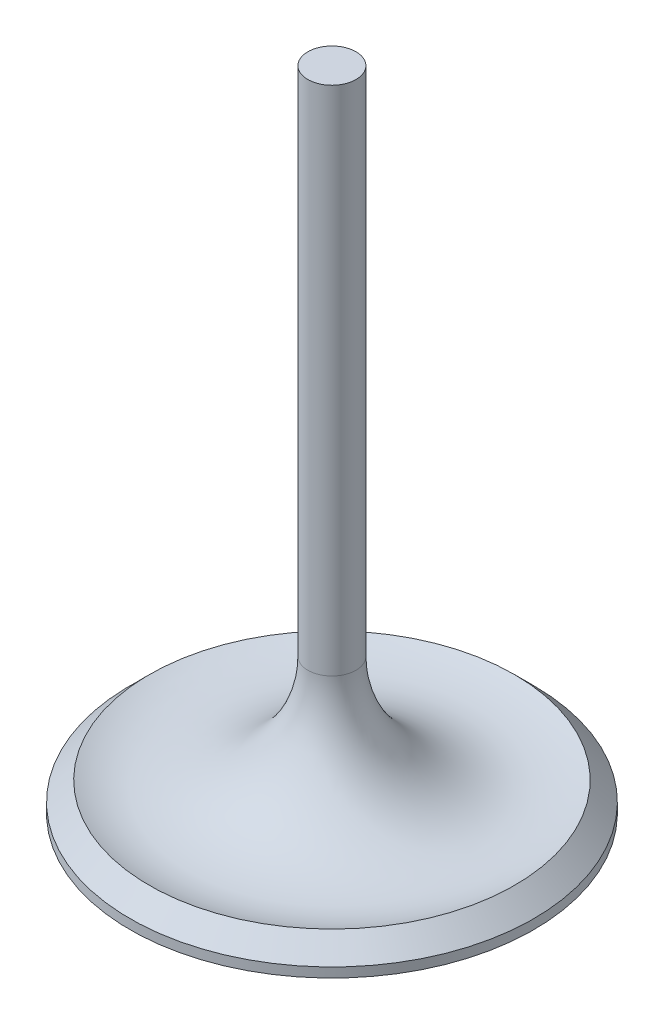
from build123d import *


with BuildPart() as part:
    # Sketch1 → Revolve1 (revolve)
    with BuildSketch(Plane.XY, mode=Mode.PRIVATE) as revolve1_sk:
        with BuildLine():
            Line((0, 0), (0, 85.55))
            Line((0, 85.55), (3.18, 85.55))
            Line((3.18, 85.55), (3.18, 17.954698654))
            ThreePointArc((3.18, 17.954698654), (9.896609701, 5.315721242), (24.13, 3.81))
            Line((24.13, 3.81), (26.67, 1.27))
            Line((26.67, 1.27), (26.67, 0))
            Line((26.67, 0), (0, 0))
        make_face()
    revolve(revolve1_sk.sketch.rotate(Axis((0, 0, 0), (0, 1, 0)), 90), axis=Axis((0, 0, 0), (0, 1, 0)))


solid = part.part
